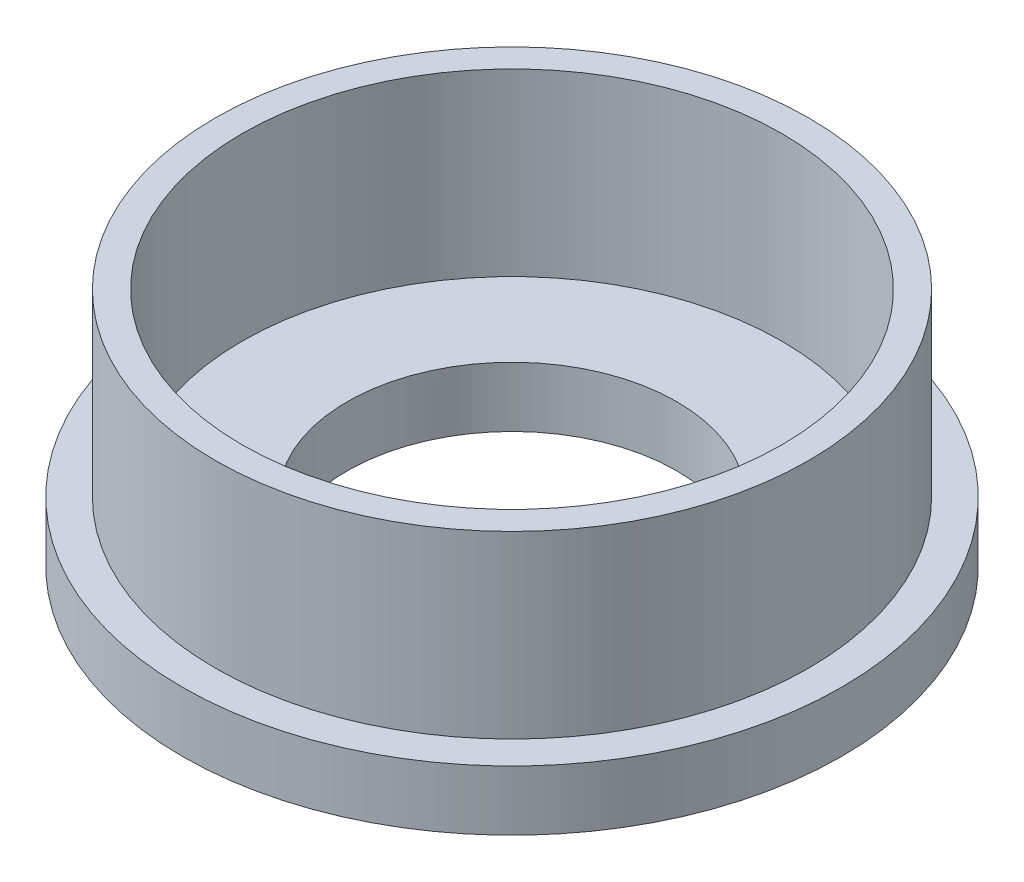
from build123d import *

# Parameters (mm, degrees)
SKETCH_1_R          = 55
EXTRUDE_1_DEPTH     = 10
SKETCH_3_R          = 49.5
SKETCH_3_R_2        = 45
EXTRUDE_2_DEPTH     = 30
SKETCH_4_R          = 27.5
CUT_EXTRUDE_1_DEPTH = 88.464278423


with BuildPart() as part:
    # 草图1 → 拉伸1 (new body)
    with BuildSketch(Plane(origin=(0, 0, 0), x_dir=(1, 0, 0), z_dir=(0, 1, 0))):
        Circle(SKETCH_1_R)
    extrude(amount=EXTRUDE_1_DEPTH)

    # 草图3 → 拉伸2 (add)
    with BuildSketch(Plane(origin=(0, 10, 0), x_dir=(-1, 0, 0), z_dir=(0, 1, 0))):
        Circle(SKETCH_3_R)
        Circle(SKETCH_3_R_2, mode=Mode.SUBTRACT)
    extrude(amount=EXTRUDE_2_DEPTH)

    # 草图4 → 切除-拉伸1 (cut, through all)
    with BuildSketch(Plane.XZ):
        Circle(SKETCH_4_R)
    extrude(amount=-CUT_EXTRUDE_1_DEPTH, mode=Mode.SUBTRACT)


solid = part.part
